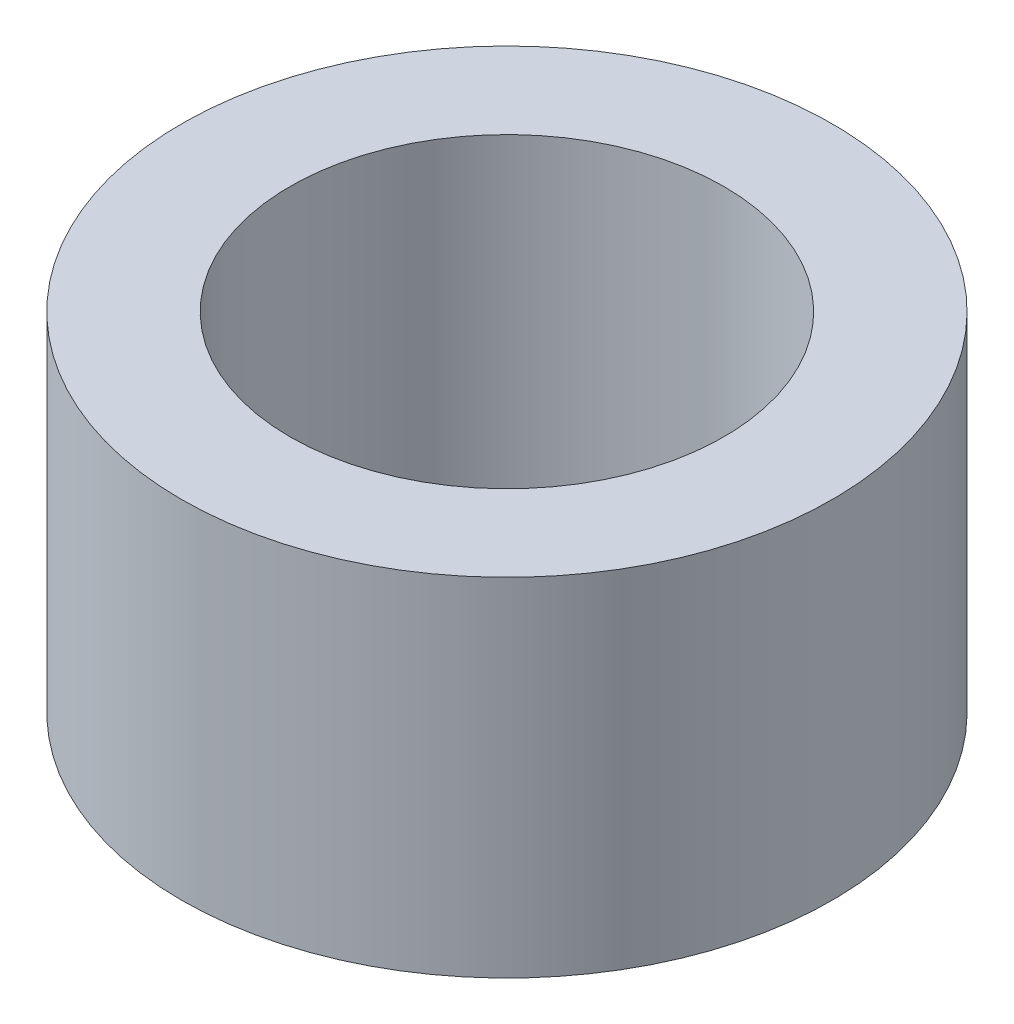
from build123d import *

# Parameters (mm, degrees)
SKETCH_1_R      = 7.5
SKETCH_1_R_2    = 5
EXTRUDE_1_DEPTH = 8


with BuildPart() as part:
    # 草图1 → 凸台-拉伸1 (new body)
    with BuildSketch(Plane(origin=(0, 0, 0), x_dir=(1, 0, 0), z_dir=(0, 1, 0))):
        with Locations(Location((0, 0, 0), (0, 0, 270))):
            Circle(SKETCH_1_R)
        with Locations(Location((0, 0, 0), (0, 0, 270))):
            Circle(SKETCH_1_R_2, mode=Mode.SUBTRACT)
    extrude(amount=EXTRUDE_1_DEPTH)


solid = part.part
